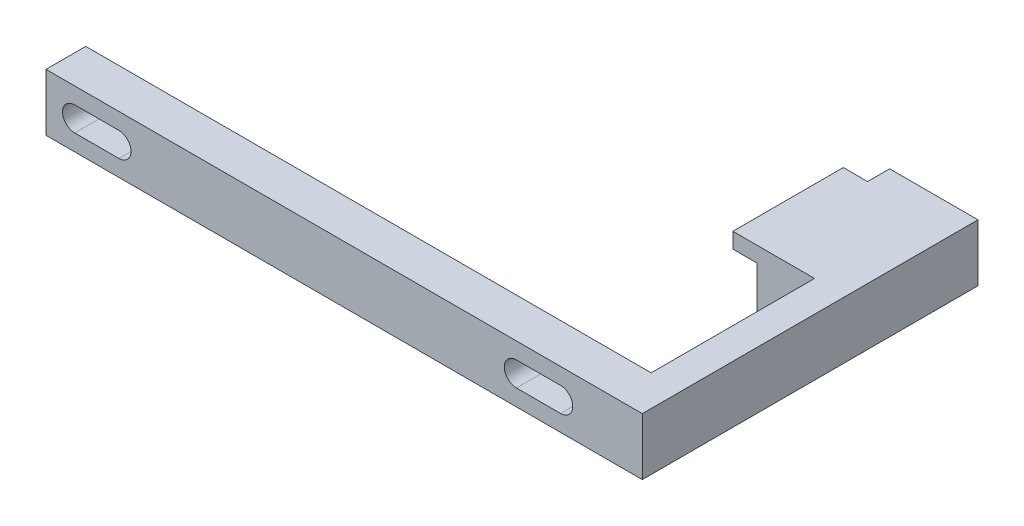
from build123d import *

# Parameters (mm, degrees)
SKETCH1_W           = 135
SKETCH1_H           = 12.93762629
BOSS_EXTRUDE1_DEPTH = 9
SKETCH2_W           = 7
SKETCH2_H           = 12.93762629
BOSS_EXTRUDE2_DEPTH = 54
SKETCH3_W           = 7
SKETCH3_H           = 12.93762629
BOSS_EXTRUDE5_DEPTH = 13
BOSS_EXTRUDE6_REACH = 129.212
SKETCH6_W           = 30
SKETCH6_H           = 12.93762629
SKETCH7_R           = 1.5
CUT_EXTRUDE1_DEPTH  = 5
SKETCH9_W           = 25
SKETCH9_H           = 3.5
BOSS_EXTRUDE7_DEPTH = 5.5
CUT_EXTRUDE3_DEPTH  = 9


with BuildPart() as part:
    # Sketch1 → Boss-Extrude1 (new body)
    with BuildSketch(Plane.XY):
        with Locations((60, 0)):
            Rectangle(SKETCH1_W, SKETCH1_H)
    extrude(amount=BOSS_EXTRUDE1_DEPTH)

    # Sketch2 → Boss-Extrude2 (add)
    with BuildSketch(Plane(origin=(0, 0, 0), x_dir=(-1, 0, 0), z_dir=(0, 0, -1))):
        with Locations((-124, 0)):
            Rectangle(SKETCH2_W, SKETCH2_H)
    extrude(amount=BOSS_EXTRUDE2_DEPTH)

    # Sketch3 → Boss-Extrude5 (add)
    with BuildSketch(Plane.ZY.offset(-120.5)):
        with Locations((-50.5, 0)):
            Rectangle(SKETCH3_W, SKETCH3_H)
    extrude(amount=BOSS_EXTRUDE5_DEPTH)

    # Boss-Extrude6: up to this face of the body (flat: up to its plane)
    boss_extrude6_end = Plane(part.part.faces().sort_by_distance((127.5, 0, -22.5))[0])
    # Sketch6 → Boss-Extrude6 (add, up to the picked face)
    with BuildSketch(Plane.ZY.offset(-107.5), mode=Mode.PRIVATE) as boss_extrude6_sk1:
        with Locations((-52, 0)):
            Rectangle(SKETCH6_W, SKETCH6_H)
    boss_extrude6_tool1 = split(extrude(boss_extrude6_sk1.sketch, amount=-BOSS_EXTRUDE6_REACH, mode=Mode.PRIVATE), bisect_by=boss_extrude6_end, keep=Keep.BOTH, mode=Mode.PRIVATE)
    add(boss_extrude6_tool1.solids().sort_by(Axis((107.5, 0, -52), (1, 0, 0)))[0])

    # Sketch7 → Cut-Extrude1 (cut)
    with BuildSketch(Plane.ZY.offset(-107.5)):
        with Locations((-39.75, -3.718813145)):
            Circle(SKETCH7_R)
        with Locations((-58.8, -3.718813145)):
            Circle(SKETCH7_R)
    extrude(amount=-CUT_EXTRUDE1_DEPTH, mode=Mode.SUBTRACT)

    # Sketch9 → Boss-Extrude7 (add)
    with BuildSketch(Plane.ZY.offset(-107.5)):
        with Locations((-49.5, 4.718813145)):
            Rectangle(SKETCH9_W, SKETCH9_H)
    extrude(amount=BOSS_EXTRUDE7_DEPTH)

    # Sketch12 → Cut-Extrude3 (cut)
    with BuildSketch(Plane.XY.offset(9)):
        with BuildLine():
            Line((-1, 2.75), (9, 2.75))
            ThreePointArc((9, 2.75), (11.75, 0), (9, -2.75))
            Line((9, -2.75), (-1, -2.75))
            ThreePointArc((-1, -2.75), (-3.75, 0), (-1, 2.75))
        make_face()
        with BuildLine():
            Line((109, -2.75), (99, -2.75))
            ThreePointArc((99, -2.75), (96.25, 0), (99, 2.75))
            Line((99, 2.75), (109, 2.75))
            ThreePointArc((109, 2.75), (111.75, 0), (109, -2.75))
        make_face()
    extrude(amount=-CUT_EXTRUDE3_DEPTH, mode=Mode.SUBTRACT)


solid = part.part
